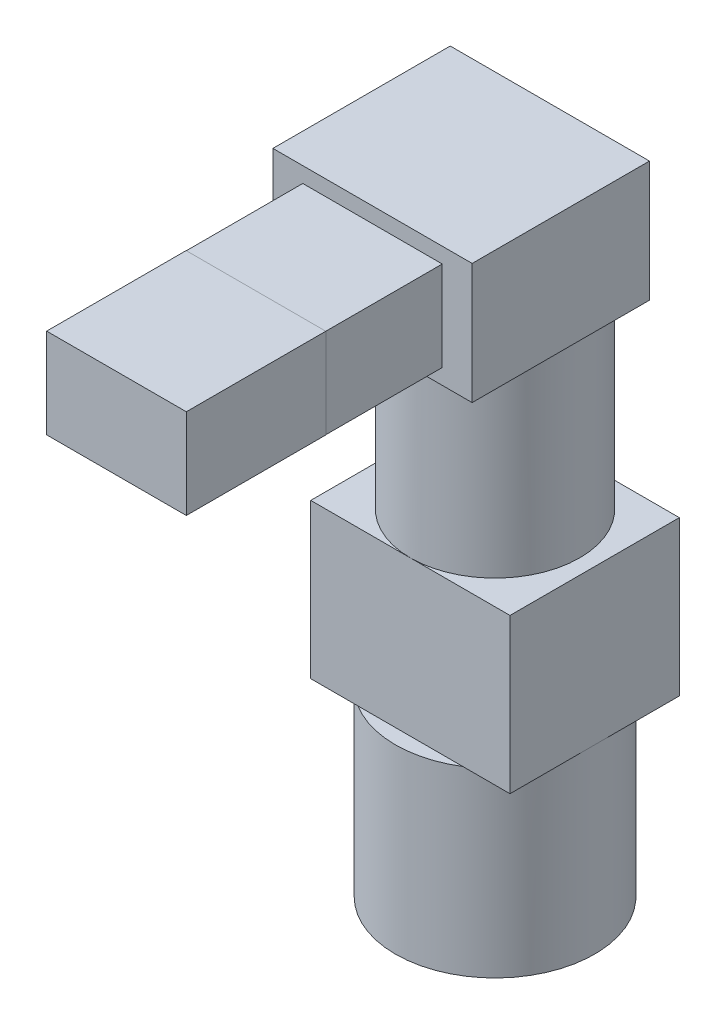
from build123d import *

# Parameters (mm, degrees)
SKETCH1_R                = 50
BOSS_EXTRUDE1_DEPTH      = 91
BOSS_EXTRUDE2_DEPTH      = 50
BOSS_EXTRUDE2_DEPTH_BACK = 50
SKETCH2_W                = 85
SKETCH2_H                = 77.5
SKETCH4_R                = 42.5
BOSS_EXTRUDE3_DEPTH      = 135
BOSS_EXTRUDE4_DEPTH      = 50
BOSS_EXTRUDE4_DEPTH_BACK = 50
SKETCH5_W                = 89
SKETCH5_H                = 60.5
SKETCH6_W                = 70
SKETCH6_H                = 45
BOSS_EXTRUDE5_DEPTH      = 58.5
SKETCH7_W                = 70.1
SKETCH7_H                = 45.1
BOSS_EXTRUDE6_DEPTH      = 70


with BuildPart() as part:
    # Sketch1 → Boss-Extrude1 (new body)
    with BuildSketch(Plane(origin=(0, 0, 0), x_dir=(1, 0, 0), z_dir=(0, 1, 0))):
        Circle(SKETCH1_R)
    extrude(amount=BOSS_EXTRUDE1_DEPTH)

    # Sketch2 → Boss-Extrude2 (add, two sides: drawn at the far end of the back side and taken through both)
    with BuildSketch(Plane(origin=(0, 0, 0), x_dir=(0, 0, -1), z_dir=(1, 0, 0)).offset(-BOSS_EXTRUDE2_DEPTH_BACK)):
        with Locations((0, 129.75)):
            Rectangle(SKETCH2_W, SKETCH2_H)
    extrude(amount=BOSS_EXTRUDE2_DEPTH + BOSS_EXTRUDE2_DEPTH_BACK)

    # Sketch4 → Boss-Extrude3 (add)
    with BuildSketch(Plane(origin=(0, 135.5, 0), x_dir=(1, 0, 0), z_dir=(0, 1, 0))):
        Circle(SKETCH4_R)
    extrude(amount=BOSS_EXTRUDE3_DEPTH)

    # Sketch5 → Boss-Extrude4 (add, two sides: drawn at the far end of the back side and taken through both)
    with BuildSketch(Plane(origin=(0, 0, 0), x_dir=(0, 0, -1), z_dir=(1, 0, 0)).offset(-BOSS_EXTRUDE4_DEPTH_BACK)):
        with Locations((-17, 300.75)):
            Rectangle(SKETCH5_W, SKETCH5_H)
    extrude(amount=BOSS_EXTRUDE4_DEPTH + BOSS_EXTRUDE4_DEPTH_BACK)

    # Sketch6 → Boss-Extrude5 (add)
    with BuildSketch(Plane.XY.offset(61.5)):
        with Locations((0, 300.75)):
            Rectangle(SKETCH6_W, SKETCH6_H)
    extrude(amount=BOSS_EXTRUDE5_DEPTH)

    # Sketch7 → Boss-Extrude6 (add)
    with BuildSketch(Plane.XY.offset(120)):
        with Locations((0, 300.75)):
            Rectangle(SKETCH7_W, SKETCH7_H)
    extrude(amount=BOSS_EXTRUDE6_DEPTH)


solid = part.part
